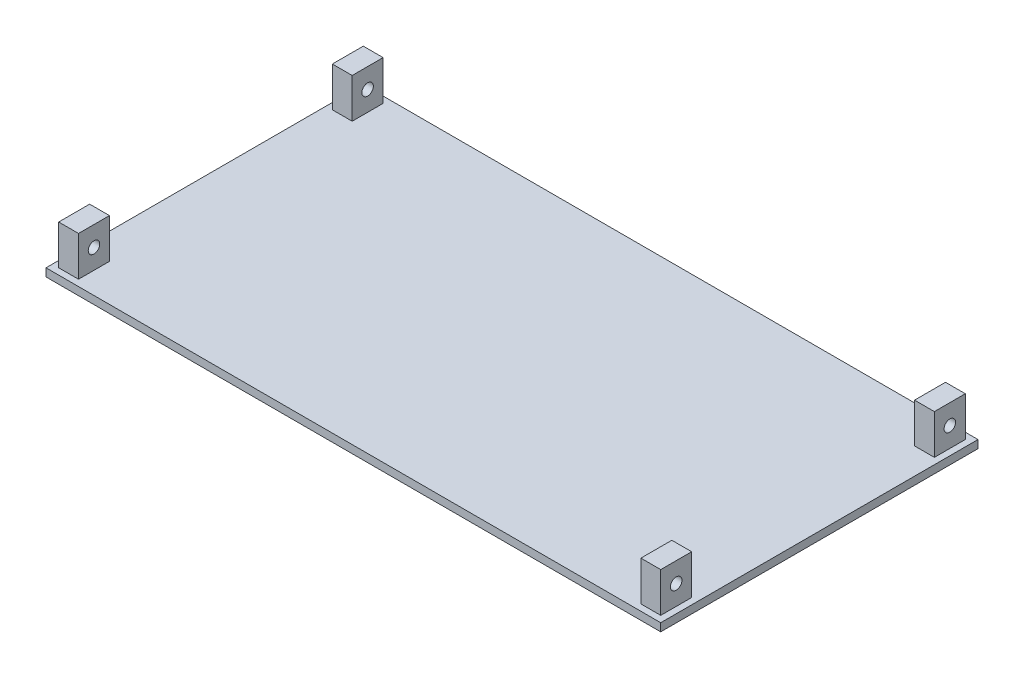
from build123d import *

# Parameters (mm, degrees)
SKETCH1_W           = 155
SKETCH1_H           = 80
BOSS_EXTRUDE1_DEPTH = 2
SKETCH2_W           = 5
SKETCH2_H           = 7.8
BOSS_EXTRUDE2_DEPTH = 10
SKETCH3_R           = 1.45
CUT_EXTRUDE1_DEPTH  = 210
SKETCH4_R           = 1.45
CUT_EXTRUDE2_DEPTH  = 210


with BuildPart() as part:
    # Sketch1 → Boss-Extrude1 (new body)
    with BuildSketch(Plane(origin=(0, 0, 0), x_dir=(1, 0, 0), z_dir=(0, 1, 0))):
        with Locations((-77.5, 40)):
            Rectangle(SKETCH1_W, SKETCH1_H)
    extrude(amount=BOSS_EXTRUDE1_DEPTH)

    # Sketch2 → Boss-Extrude2 (add)
    with BuildSketch(Plane(origin=(0, 2, 0), x_dir=(1, 0, 0), z_dir=(0, 1, 0))):
        with Locations((-150.9, 74.5)):
            Rectangle(SKETCH2_W, SKETCH2_H)
        with Locations((-150.9, 5.5)):
            Rectangle(SKETCH2_W, SKETCH2_H)
        with Locations((-4.1, 74.5)):
            Rectangle(SKETCH2_W, SKETCH2_H)
        with Locations((-4.1, 5.5)):
            Rectangle(SKETCH2_W, SKETCH2_H)
    extrude(amount=BOSS_EXTRUDE2_DEPTH)

    # Sketch3 → Cut-Extrude1 (cut)
    with BuildSketch(Plane.ZY.offset(153.4)):
        with Locations((-5.5, 7)):
            Circle(SKETCH3_R)
    extrude(amount=-CUT_EXTRUDE1_DEPTH, mode=Mode.SUBTRACT)

    # Sketch4 → Cut-Extrude2 (cut)
    with BuildSketch(Plane(origin=(-1.6, 0, 0), x_dir=(0, 0, -1), z_dir=(1, 0, 0))):
        with Locations((74.5, 7)):
            Circle(SKETCH4_R)
    extrude(amount=-CUT_EXTRUDE2_DEPTH, mode=Mode.SUBTRACT)


solid = part.part
